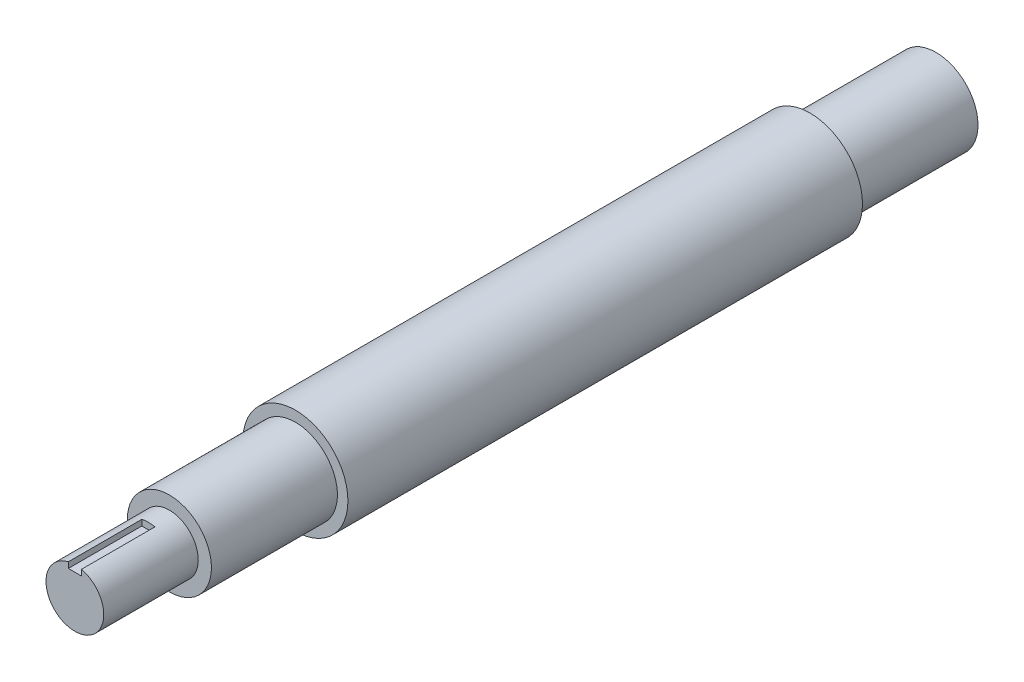
from build123d import *

# Parameters (mm, degrees)
SKETCH1_R           = 31.75
BOSS_EXTRUDE1_DEPTH = 155.575
SKETCH2_R           = 25.4
BOSS_EXTRUDE2_DEPTH = 76.2
BOSS_EXTRUDE3_START = 76.2
SKETCH3_R           = 25.4
BOSS_EXTRUDE3_DEPTH = 76.2
SKETCH18_R          = 17.4625
BOSS_EXTRUDE6_DEPTH = 57.15
SKETCH20_W          = 7.9248
SKETCH20_H          = 7.9248
CUT_EXTRUDE1_DEPTH  = 44.45


with BuildPart() as part:
    # Sketch1 → Boss-Extrude1 (new, symmetric)
    with BuildSketch(Plane.XY):
        Circle(SKETCH1_R)
    extrude(amount=BOSS_EXTRUDE1_DEPTH, both=True)

    # Sketch2 → Boss-Extrude2 (add)
    with BuildSketch(Plane.XY.offset(155.575)):
        with Locations(Location((0, 0, 0), (0, 0, 180))):
            Circle(SKETCH2_R)
    extrude(amount=BOSS_EXTRUDE2_DEPTH)

    # Sketch3 → Boss-Extrude3 (add)
    with BuildSketch(Plane(origin=(0, 0, -155.575), x_dir=(-1, 0, 0), z_dir=(0, 0, -1)).offset(BOSS_EXTRUDE3_START)):
        Circle(SKETCH3_R)
    extrude(amount=-BOSS_EXTRUDE3_DEPTH)

    # Sketch18 → Boss-Extrude6 (add)
    with BuildSketch(Plane.XY.offset(231.775)):
        Circle(SKETCH18_R)
    extrude(amount=BOSS_EXTRUDE6_DEPTH)

    # Sketch20 → Cut-Extrude1 (cut)
    with BuildSketch(Plane.XY.offset(288.925)):
        with Locations((0, 17.4625)):
            Rectangle(SKETCH20_W, SKETCH20_H)
    extrude(amount=-CUT_EXTRUDE1_DEPTH, mode=Mode.SUBTRACT)


solid = part.part
